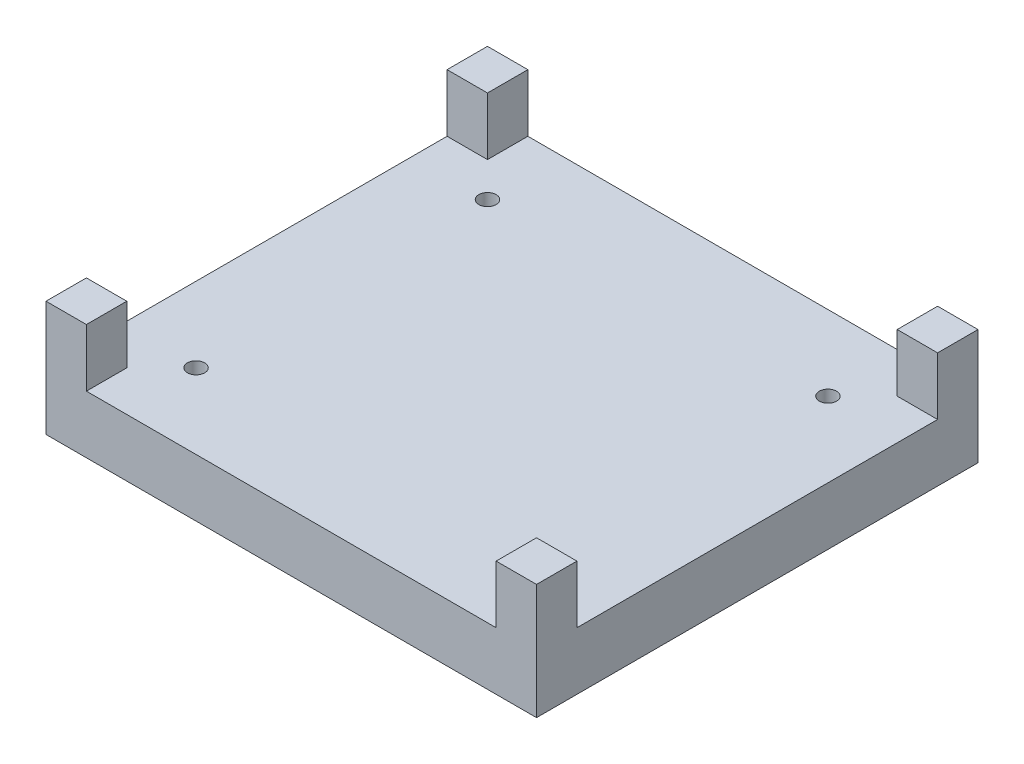
from build123d import *

# Parameters (mm, degrees)
SKETCH1_W           = 85
SKETCH1_H           = 76.5
SKETCH1_R           = 1.5
BOSS_EXTRUDE1_DEPTH = 10
SKETCH2_W           = 7
SKETCH2_H           = 7
BOSS_EXTRUDE2_DEPTH = 10


with BuildPart() as part:
    # Sketch1 → Boss-Extrude1 (new body)
    with BuildSketch(Plane(origin=(0, 0, 0), x_dir=(1, 0, 0), z_dir=(0, 1, 0))):
        Rectangle(SKETCH1_W, SKETCH1_H)
        with Locations(Location((-29.5, 25.25, 0), (0, 0, 270))):
            Circle(SKETCH1_R, mode=Mode.SUBTRACT)
        with Locations(Location((-29.5, -25.25, 0), (0, 0, 270))):
            Circle(SKETCH1_R, mode=Mode.SUBTRACT)
        with Locations(Location((29.5, -25.25, 0), (0, 0, 270))):
            Circle(SKETCH1_R, mode=Mode.SUBTRACT)
        with Locations(Location((29.5, 25.25, 0), (0, 0, 270))):
            Circle(SKETCH1_R, mode=Mode.SUBTRACT)
    extrude(amount=BOSS_EXTRUDE1_DEPTH)

    # Sketch2 → Boss-Extrude2 (add)
    with BuildSketch(Plane(origin=(0, 10, 0), x_dir=(1, 0, 0), z_dir=(0, 1, 0))):
        with Locations((-39, 34.75)):
            Rectangle(SKETCH2_W, SKETCH2_H)
        with Locations((39, 34.75)):
            Rectangle(SKETCH2_W, SKETCH2_H)
        with Locations((-39, -34.75)):
            Rectangle(SKETCH2_W, SKETCH2_H)
        with Locations((39, -34.75)):
            Rectangle(SKETCH2_W, SKETCH2_H)
    extrude(amount=BOSS_EXTRUDE2_DEPTH)


solid = part.part
